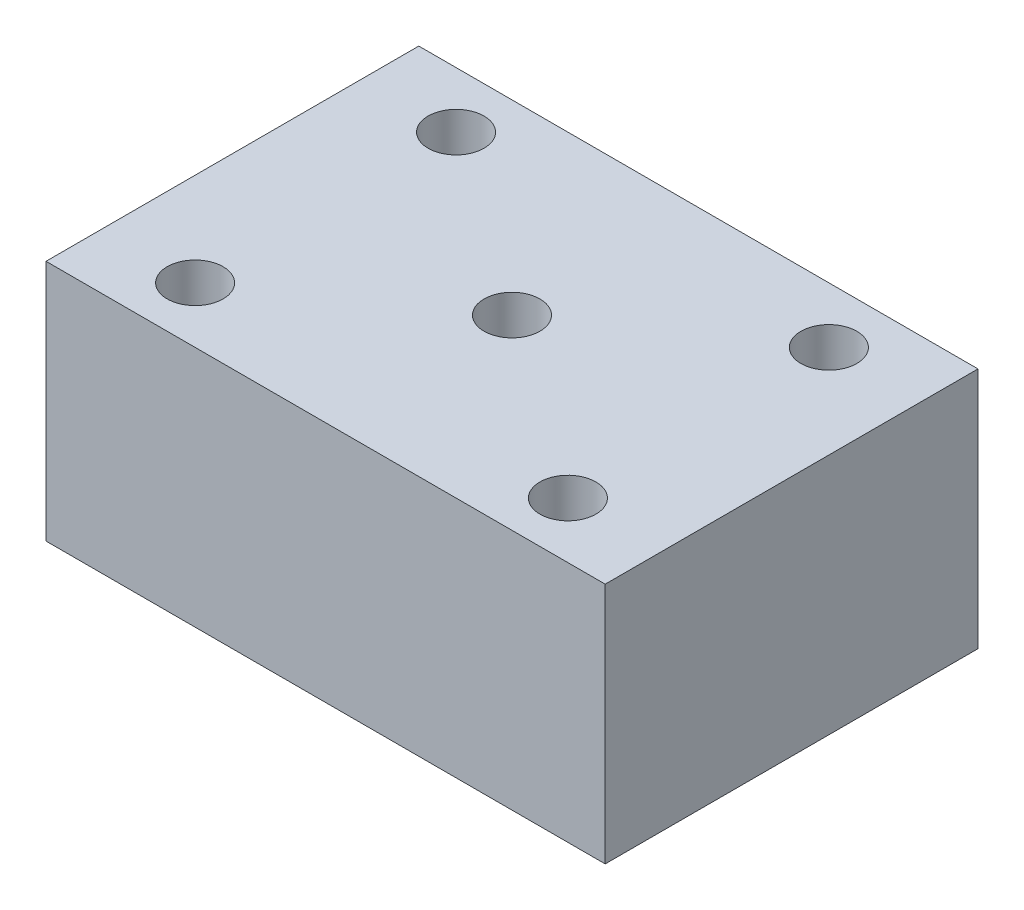
from build123d import *

# Parameters (mm, degrees)
SKETCH_1_W      = 30
SKETCH_1_H      = 20
SKETCH_1_R      = 1.5
EXTRUDE_1_DEPTH = 13


with BuildPart() as part:
    # 草图1 → 凸台-拉伸1 (new body)
    with BuildSketch(Plane(origin=(0, 0, 0), x_dir=(1, 0, 0), z_dir=(0, 1, 0))):
        Rectangle(SKETCH_1_W, SKETCH_1_H)
        with Locations(Location((-10, -7, 0), (0, 0, 90))):
            Circle(SKETCH_1_R, mode=Mode.SUBTRACT)
        with Locations(Location((10, -7, 0), (0, 0, 90))):
            Circle(SKETCH_1_R, mode=Mode.SUBTRACT)
        with Locations(Location((10, 7, 0), (0, 0, 90))):
            Circle(SKETCH_1_R, mode=Mode.SUBTRACT)
        with Locations(Location((-10, 7, 0), (0, 0, 90))):
            Circle(SKETCH_1_R, mode=Mode.SUBTRACT)
        with Locations(Location((0, 0, 0), (0, 0, 90))):
            Circle(SKETCH_1_R, mode=Mode.SUBTRACT)
    extrude(amount=EXTRUDE_1_DEPTH)


solid = part.part
